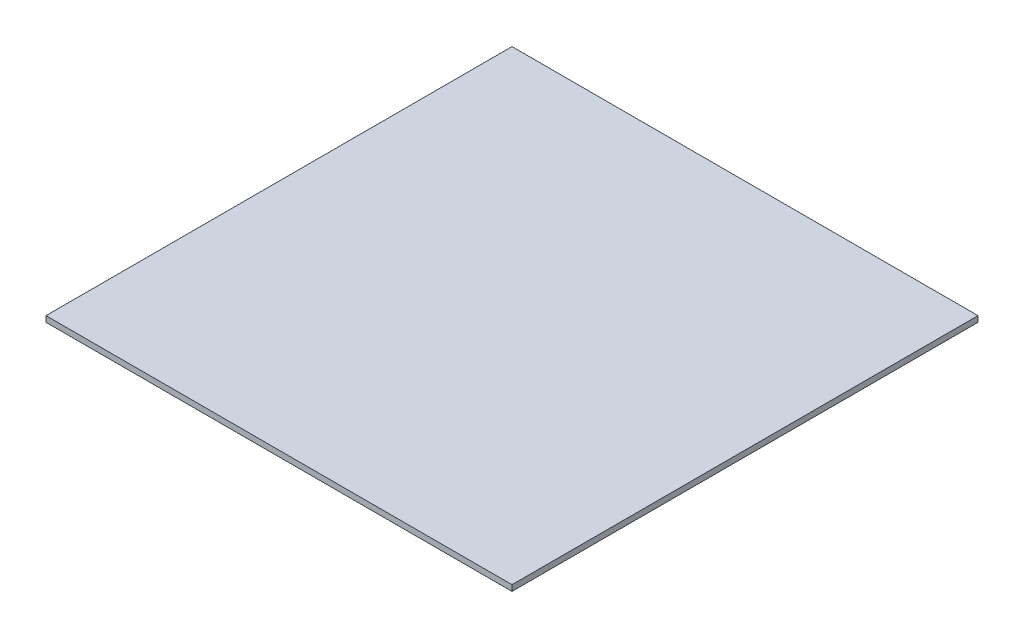
from build123d import *

# Parameters (mm, degrees)
SKETCH1_W           = 254
SKETCH1_H           = 254
BOSS_EXTRUDE1_DEPTH = 3.175


with BuildPart() as part:
    # Sketch1 → Boss-Extrude1 (new body)
    with BuildSketch(Plane(origin=(0, 0, 0), x_dir=(1, 0, 0), z_dir=(0, 1, 0))):
        Rectangle(SKETCH1_W, SKETCH1_H)
    extrude(amount=BOSS_EXTRUDE1_DEPTH)


solid = part.part
